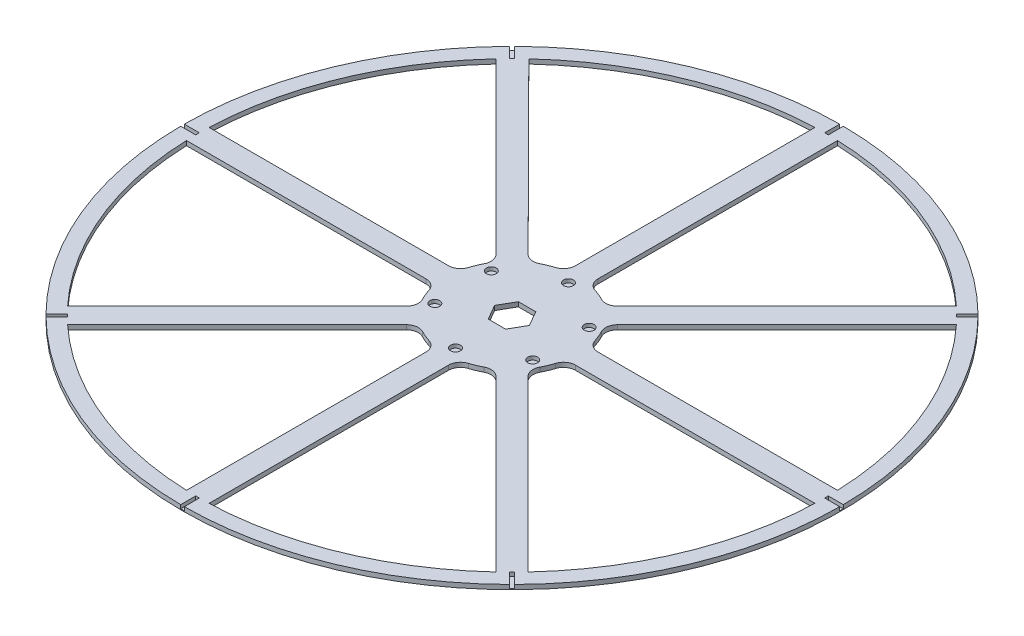
from build123d import *

# Parameters (mm, degrees)
SKETCH1_R           = 138.90625
BOSS_EXTRUDE1_DEPTH = 1.905
SKETCH2_R           = 27.94
BOSS_EXTRUDE2_DEPTH = 1.905
SKETCH3_R           = 2.0828
CUT_EXTRUDE1_DEPTH  = 1.524
FILLET1_R           = 5.08
SKETCH4_W           = 1.524
SKETCH4_H           = 6.35
CUT_EXTRUDE2_DEPTH  = 1.524
CIRPATTERN1_COUNT   = 8
CUT_EXTRUDE3_DEPTH  = 197.452339266


with BuildPart() as part:
    # Sketch1 → Boss-Extrude1 (new body)
    with BuildSketch(Plane(origin=(0, 0, 0), x_dir=(1, 0, 0), z_dir=(0, 1, 0))):
        with Locations(Location((0, 0, 0), (0, 0, 90))):
            Circle(SKETCH1_R)
        with BuildLine():
            ThreePointArc((-97.038504037, 90.303311946), (-122.466006281, 50.727080731), (-132.470668481, 4.7625))
            Line((-132.470668481, 4.7625), (-11.497692091, 4.7625))
            Line((-11.497692091, 4.7625), (-97.038504037, 90.303311946))
        make_face(mode=Mode.SUBTRACT)
        with BuildLine():
            ThreePointArc((-132.470668481, -4.7625), (-122.466006281, -50.727080731), (-97.038504037, -90.303311946))
            Line((-97.038504037, -90.303311946), (-11.497692091, -4.7625))
            Line((-11.497692091, -4.7625), (-132.470668481, -4.7625))
        make_face(mode=Mode.SUBTRACT)
        with BuildLine():
            ThreePointArc((-90.303311946, -97.038504037), (-50.727080731, -122.466006281), (-4.7625, -132.470668481))
            Line((-4.7625, -132.470668481), (-4.7625, -11.497692091))
            Line((-4.7625, -11.497692091), (-90.303311946, -97.038504037))
        make_face(mode=Mode.SUBTRACT)
        with BuildLine():
            ThreePointArc((4.7625, -132.470668481), (50.727080731, -122.466006281), (90.303311946, -97.038504037))
            Line((90.303311946, -97.038504037), (4.7625, -11.497692091))
            Line((4.7625, -11.497692091), (4.7625, -132.470668481))
        make_face(mode=Mode.SUBTRACT)
        with BuildLine():
            ThreePointArc((97.038504037, -90.303311946), (122.466006281, -50.727080731), (132.470668481, -4.7625))
            Line((132.470668481, -4.7625), (11.497692091, -4.7625))
            Line((11.497692091, -4.7625), (97.038504037, -90.303311946))
        make_face(mode=Mode.SUBTRACT)
        with BuildLine():
            ThreePointArc((132.470668481, 4.7625), (122.466006281, 50.727080731), (97.038504037, 90.303311946))
            Line((97.038504037, 90.303311946), (11.497692091, 4.7625))
            Line((11.497692091, 4.7625), (132.470668481, 4.7625))
        make_face(mode=Mode.SUBTRACT)
        with BuildLine():
            ThreePointArc((90.303311946, 97.038504037), (50.727080731, 122.466006281), (4.7625, 132.470668481))
            Line((4.7625, 132.470668481), (4.7625, 11.497692091))
            Line((4.7625, 11.497692091), (90.303311946, 97.038504037))
        make_face(mode=Mode.SUBTRACT)
        with BuildLine():
            ThreePointArc((-4.7625, 132.470668481), (-50.612212833, 122.513523034), (-90.121152576, 97.207701714))
            Line((-90.121152576, 97.207701714), (-4.7625, 11.497692091))
            Line((-4.7625, 11.497692091), (-4.7625, 132.470668481))
        make_face(mode=Mode.SUBTRACT)
    extrude(amount=BOSS_EXTRUDE1_DEPTH)

    # Sketch2 → Boss-Extrude2 (add)
    with BuildSketch(Plane(origin=(0, 1.905, 0), x_dir=(1, 0, 0), z_dir=(0, 1, 0))):
        Circle(SKETCH2_R)
    extrude(amount=-BOSS_EXTRUDE2_DEPTH)

    # Sketch3 → Cut-Extrude1 (cut)
    with BuildSketch(Plane(origin=(0, 1.905, 0), x_dir=(1, 0, 0), z_dir=(0, 1, 0))):
        with Locations(Location((0, 23.8125, 0), (0, 0, 270))):
            Circle(SKETCH3_R)
        with Locations(Location((20.622229928, 11.90625, 0), (0, 0, 270))):
            Circle(SKETCH3_R)
        with Locations(Location((20.622229928, -11.90625, 0), (0, 0, 270))):
            Circle(SKETCH3_R)
        with Locations(Location((0, -23.8125, 0), (0, 0, 270))):
            Circle(SKETCH3_R)
        with Locations(Location((-20.622229928, -11.90625, 0), (0, 0, 270))):
            Circle(SKETCH3_R)
        with Locations(Location((-20.622229928, 11.90625, 0), (0, 0, 270))):
            Circle(SKETCH3_R)
    extrude(amount=-CUT_EXTRUDE1_DEPTH, mode=Mode.SUBTRACT)

    # Fillet1
    fillet1_edges = [part.edges().sort_by_distance(p)[0] for p in [
        (-16.072522378, 0.9525, -22.854269282),
        (4.7625, 0.9525, -27.531113195),
        (22.835032879, 0.9525, -16.099840788),
        (27.531113195, 0.9525, 4.7625),
        (16.099840788, 0.9525, 22.835032879),
        (-4.7625, 0.9525, 27.531113195),
        (-22.835032879, 0.9525, 16.099840788),
        (-27.531113195, 0.9525, -4.7625),
        (-22.835032879, 0.9525, -16.099840788),
        (-4.7625, 0.9525, -27.531113195),
        (16.099840788, 0.9525, -22.835032879),
        (27.531113195, 0.9525, -4.7625),
        (22.835032879, 0.9525, 16.099840788),
        (4.7625, 0.9525, 27.531113195),
        (-16.099840788, 0.9525, 22.835032879),
        (-27.531113195, 0.9525, 4.7625),
    ]]
    fillet(fillet1_edges, radius=FILLET1_R)

    # Sketch4 → Cut-Extrude2 (cut)
    with BuildSketch(Plane(origin=(0, 1.905, 0), x_dir=(1, 0, 0), z_dir=(0, 1, 0))):
        with Locations((0, 135.73125)):
            Rectangle(SKETCH4_W, SKETCH4_H)
    cut_extrude2 = extrude(amount=-CUT_EXTRUDE2_DEPTH, mode=Mode.SUBTRACT)

    # CirPattern1: Cut-Extrude2 ×8 about axis
    cirpattern1_axis = Axis((0, 0, 0), (0, 1, 0))
    for i in range(1, CIRPATTERN1_COUNT):
        add(cut_extrude2.rotate(cirpattern1_axis, i * 360 / CIRPATTERN1_COUNT), mode=Mode.SUBTRACT)

    # Sketch5 → Cut-Extrude3 (cut, through all)
    with BuildSketch(Plane(origin=(0, 1.905, 0), x_dir=(1, 0, 0), z_dir=(0, 1, 0))):
        Polygon((3.666174209, 6.35), (-3.666174209, 6.35), (-7.332348419, 0), (-3.666174209, -6.35), (3.666174209, -6.35), (7.332348419, 0), align=None)
    extrude(amount=-CUT_EXTRUDE3_DEPTH, mode=Mode.SUBTRACT)


solid = part.part
